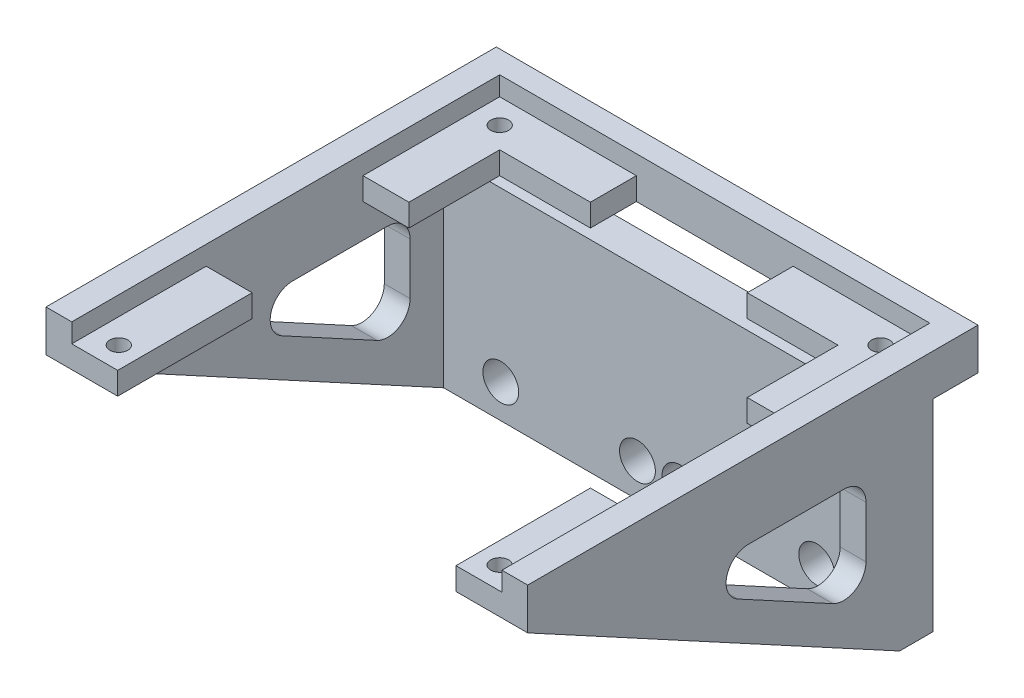
from build123d import *

# Parameters (mm, degrees)
SKETCH1_W                  = 43
SKETCH1_H                  = 43
BOSS_EXTRUDE1_DEPTH        = 24
SKETCH2_W                  = 38.4
SKETCH2_H                  = 38.2
CUT_EXTRUDE1_DEPTH         = 1.7
F_1_6_1_6_DIAMETER_HOLE1_D = 1.6
SKETCH5_W                  = 30.2
SKETCH5_H                  = 34.1
CUT_EXTRUDE2_DEPTH         = 2
SKETCH6_W                  = 14
SKETCH6_H                  = 12
CUT_EXTRUDE3_DEPTH         = 38.706630717
SKETCH7_W                  = 28.9
SKETCH7_H                  = 55.98263728
CUT_EXTRUDE4_DEPTH         = 37.559403715
SKETCH8_W                  = 7.05
SKETCH8_H                  = 20.3
BOSS_EXTRUDE2_DEPTH        = 8.2
SKETCH9_W                  = 36.19131864
SKETCH9_H                  = 11.8
CUT_EXTRUDE5_DEPTH         = 4.1
F_2_9_2_9_DIAMETER_HOLE1_D = 2.9
SKETCH13_W                 = 45
SKETCH13_H                 = 30.01736272
CUT_EXTRUDE6_DEPTH         = 11.8
SKETCH_1_W                 = 54.379926199
SKETCH_1_H                 = 25.742878229
CUT_EXTRUDE_1_DEPTH        = 61.495371724
SKETCH_2_W                 = 51.169507394
SKETCH_2_H                 = 8.248398276
CUT_EXTRUDE_4_DEPTH        = 10
SKETCH_3_W                 = 38.4
SKETCH_3_H                 = 14
CUT_EXTRUDE_5_DEPTH        = 31.629887365
SKETCH_4_W                 = 43
SKETCH_4_H                 = 3
EXTRUDE_1_DEPTH            = 18
SKETCH_5_R                 = 1.6
CUT_EXTRUDE_6_DEPTH        = 49.463285072
SKETCH_5_4_R               = 2.75
EXTRUDE_2_DEPTH            = 3
FILLET_1_R                 = 1
EXTRUDE_3_DEPTH            = 2.3
EXTRUDE_4_DEPTH            = 2.3
FILLET_2_R                 = 2


with BuildPart() as part:
    # Sketch1 → Boss-Extrude1 (new body)
    with BuildSketch(Plane(origin=(0, 0, 0), x_dir=(1, 0, 0), z_dir=(0, 1, 0))):
        Rectangle(SKETCH1_W, SKETCH1_H)
    extrude(amount=BOSS_EXTRUDE1_DEPTH)

    # Sketch2 → Cut-Extrude1 (cut)
    with BuildSketch(Plane(origin=(0, 24, 0), x_dir=(1, 0, 0), z_dir=(0, 1, 0))):
        with Locations((0, -2.4)):
            Rectangle(SKETCH2_W, SKETCH2_H)
    extrude(amount=-CUT_EXTRUDE1_DEPTH, mode=Mode.SUBTRACT)

    # Ø1.6 (1.6) Diameter Hole1 (through all)
    with Locations(Plane(origin=(-17, 22.3, -14.5), x_dir=(0, 0, 1), z_dir=(0, 1, 0))):
        with Locations((0, 0), (0, 34), (34, 34), (34, 0)):
            Hole(F_1_6_1_6_DIAMETER_HOLE1_D / 2)

    # Sketch5 → Cut-Extrude2 (cut)
    with BuildSketch(Plane(origin=(0, 22.3, 0), x_dir=(1, 0, 0), z_dir=(0, 1, 0))):
        with Locations((0, -4.45)):
            Rectangle(SKETCH5_W, SKETCH5_H)
    extrude(amount=-CUT_EXTRUDE2_DEPTH, mode=Mode.SUBTRACT)

    # Sketch6 → Cut-Extrude3 (cut, through all)
    with BuildSketch(Plane(origin=(0, 22.3, 0), x_dir=(1, 0, 0), z_dir=(0, 1, 0))):
        with Locations((0, 10.7)):
            Rectangle(SKETCH6_W, SKETCH6_H)
    extrude(amount=-CUT_EXTRUDE3_DEPTH, mode=Mode.SUBTRACT)

    # Sketch7 → Cut-Extrude4 (cut, through all)
    with BuildSketch(Plane(origin=(0, 20.3, 0), x_dir=(1, 0, 0), z_dir=(0, 1, 0))):
        with Locations((0, -21.5)):
            Rectangle(SKETCH7_W, SKETCH7_H)
    extrude(amount=-CUT_EXTRUDE4_DEPTH, mode=Mode.SUBTRACT)

    # Sketch8 → Boss-Extrude2 (add)
    with BuildSketch(Plane.XY.offset(21.5)):
        with Locations((-17.975, 10.15)):
            Rectangle(SKETCH8_W, SKETCH8_H)
    boss_extrude2 = extrude(amount=BOSS_EXTRUDE2_DEPTH)

    # Mirror1: Boss-Extrude2 across plane
    add(boss_extrude2.mirror(Plane(origin=(0, 0, 0), x_dir=(0, 0, 1), z_dir=(1, 0, 0))))

    # Sketch9 → Cut-Extrude5 (cut)
    with BuildSketch(Plane(origin=(-14.45, 0, 0), x_dir=(0, 0, -1), z_dir=(1, 0, 0))):
        with Locations((-11.60434068, 5.9)):
            Rectangle(SKETCH9_W, SKETCH9_H)
    cut_extrude5 = extrude(amount=-CUT_EXTRUDE5_DEPTH, mode=Mode.SUBTRACT)

    # Mirror2: Cut-Extrude5 across plane
    add(cut_extrude5.mirror(Plane(origin=(0, 0, 0), x_dir=(0, 0, 1), z_dir=(1, 0, 0))), mode=Mode.SUBTRACT)

    # Ø2.9 (2.9) Diameter Hole1 (through all)
    with Locations(Plane.ZY.offset(21.5)):
        with Locations((6.7, 5.05), (18.7, 5.05)):
            Hole(F_2_9_2_9_DIAMETER_HOLE1_D / 2)

    # Sketch13 → Cut-Extrude6 (cut)
    with BuildSketch(Plane.XZ):
        with Locations((0, -21.5)):
            Rectangle(SKETCH13_W, SKETCH13_H)
    extrude(amount=-CUT_EXTRUDE6_DEPTH, mode=Mode.SUBTRACT)

    # 草图1 → 切除-拉伸1 (cut, through all)
    with BuildSketch(Plane.XY.offset(29.7)):
        with Locations((-0.875867159, 7.428560885)):
            Rectangle(SKETCH_1_W, SKETCH_1_H)
    extrude(amount=-CUT_EXTRUDE_1_DEPTH, mode=Mode.SUBTRACT)

    # 草图2 → 切除-拉伸4 (cut)
    with BuildSketch(Plane(origin=(0, 24, 0), x_dir=(1, 0, 0), z_dir=(0, 1, 0))):
        with Locations((1.669275501, 22.824199138)):
            Rectangle(SKETCH_2_W, SKETCH_2_H)
    extrude(amount=-CUT_EXTRUDE_4_DEPTH, mode=Mode.SUBTRACT)

    # 草图3 → 切除-拉伸5 (cut, through all)
    with BuildSketch(Plane.XZ.offset(-20.3)):
        with Locations((0, 2.5)):
            Rectangle(SKETCH_3_W, SKETCH_3_H)
    extrude(amount=-CUT_EXTRUDE_5_DEPTH, mode=Mode.SUBTRACT)

    # 草图4 → 凸台-拉伸1 (add)
    with BuildSketch(Plane.XZ.offset(-20.3)):
        with Locations((0, -13.2)):
            Rectangle(SKETCH_4_W, SKETCH_4_H)
    extrude(amount=EXTRUDE_1_DEPTH)

    # 草图5 → 切除-拉伸6 (cut, through all)
    with BuildSketch(Plane(origin=(0, 0, -14.7), x_dir=(-1, 0, 0), z_dir=(0, 0, -1))):
        with Locations((-1.9, 5.3)):
            Circle(SKETCH_5_R)
        with Locations((14.1, 5.3)):
            Circle(SKETCH_5_R)
    cut_extrude_6 = extrude(amount=-CUT_EXTRUDE_6_DEPTH, mode=Mode.SUBTRACT)

    # 草图5<4> → 凸台-拉伸2 (add)
    with BuildSketch(Plane(origin=(0, 0, -14.7), x_dir=(-1, 0, 0), z_dir=(0, 0, -1))):
        with Locations(Location((0, 14.3, 0), (0, 0, 180))):
            Circle(SKETCH_5_4_R)
    extrude(amount=EXTRUDE_2_DEPTH)

    # 圆角1
    fillet_1_edges = [part.edges().sort_by_distance(p)[0] for p in [
        (-2.75, 14.3, -17.7),
    ]]
    fillet(fillet_1_edges, radius=FILLET_1_R)

    # 草图6 → 凸台-拉伸3 (add)
    with BuildSketch(Plane(origin=(21.5, 0, 0), x_dir=(0, 0, -1), z_dir=(1, 0, 0))):
        Polygon((-21.5, 20.3), (11.7, 2.3), (11.7, 20.3), align=None)
        Polygon((-9.672401199, 17.3), (8.7, 7.339059591), (8.7, 17.3), align=None, mode=Mode.SUBTRACT)
    extrude(amount=-EXTRUDE_3_DEPTH)

    # 镜向1: 切除-拉伸6 across plane
    add(cut_extrude_6.mirror(Plane(origin=(0, 0, 0), x_dir=(0, 0, 1), z_dir=(1, 0, 0))), mode=Mode.SUBTRACT)

    # 草图7 → 凸台-拉伸4 (add)
    with BuildSketch(Plane.ZY.offset(21.5)):
        Polygon((-11.7, 2.3), (-11.7, 20.3), (21.5, 20.3), align=None)
        Polygon((-8.7, 17.3), (9.672401199, 17.3), (-8.7, 7.339059591), align=None, mode=Mode.SUBTRACT)
    extrude(amount=-EXTRUDE_4_DEPTH)

    # 圆角2
    fillet_2_edges = [part.edges().sort_by_distance(p)[0] for p in [
        (20.35, 17.3, 9.672401199),
        (20.35, 7.339059591, -8.7),
        (20.35, 17.3, -8.7),
        (-20.35, 7.339059591, -8.7),
        (-20.35, 17.3, 9.672401199),
        (-20.35, 17.3, -8.7),
    ]]
    fillet(fillet_2_edges, radius=FILLET_2_R)


solid = part.part
